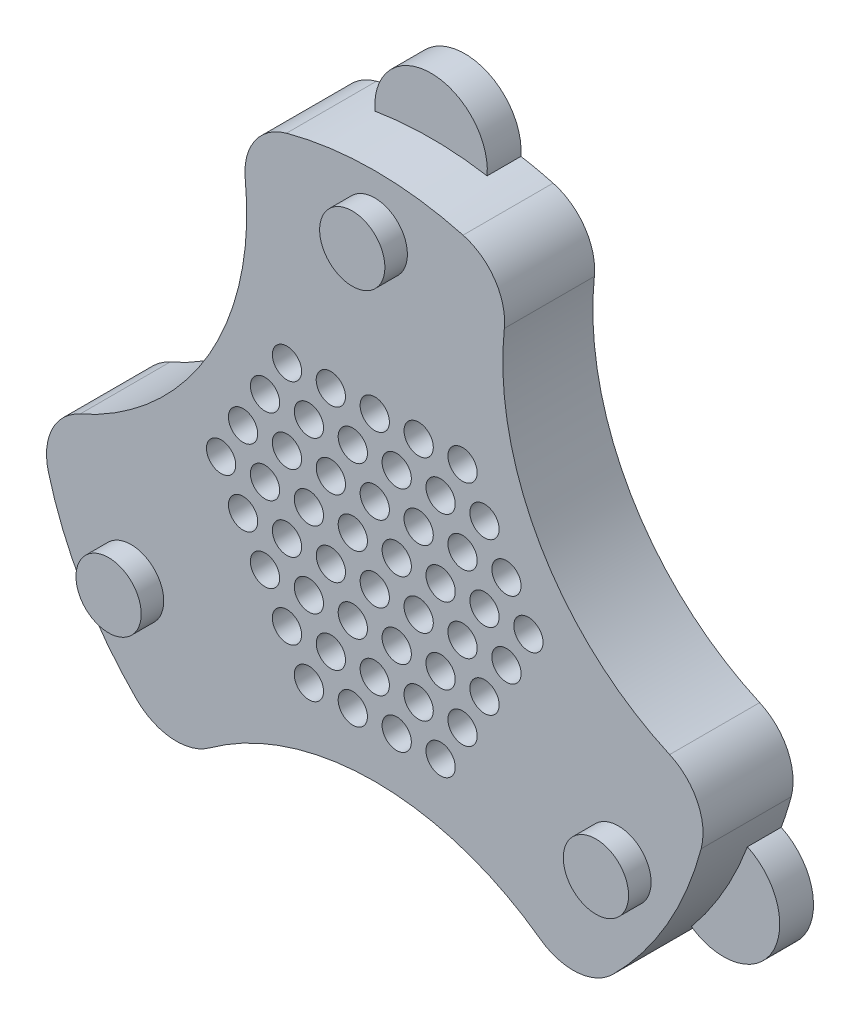
from build123d import *

# Parameters (mm, degrees)
SKETCH2_R           = 19
SKETCH2_R_2         = 1.3
BOSS_EXTRUDE1_DEPTH = 8
SKETCH3_R           = 30
SKETCH3_R_2         = 17.487995661
BOSS_EXTRUDE2_DEPTH = 8
SKETCH4_R           = 2.9
BOSS_EXTRUDE3_DEPTH = 2
SKETCH6_R           = 5
BOSS_EXTRUDE4_DEPTH = 3
SKETCH5_R           = 3
CUT_EXTRUDE1_DEPTH  = 3
SKETCH7_R           = 25
CUT_EXTRUDE2_DEPTH  = 8
FILLET2_R           = 5


with BuildPart() as part:
    # Sketch2 → Boss-Extrude1 (new body)
    with BuildSketch(Plane.XY.offset(10)):
        Circle(SKETCH2_R)
        with Locations((0, -2.215732779)):
            Circle(SKETCH2_R_2, mode=Mode.SUBTRACT)
        with Locations((3.9, -2.215732779)):
            Circle(SKETCH2_R_2, mode=Mode.SUBTRACT)
        with Locations((7.8, -2.215732779)):
            Circle(SKETCH2_R_2, mode=Mode.SUBTRACT)
        with Locations((11.7, -2.215732779)):
            Circle(SKETCH2_R_2, mode=Mode.SUBTRACT)
        with Locations((1.95, -5.593231854)):
            Circle(SKETCH2_R_2, mode=Mode.SUBTRACT)
        with Locations((3.9, -8.970730929)):
            Circle(SKETCH2_R_2, mode=Mode.SUBTRACT)
        with Locations((5.850000003, -12.348230002)):
            Circle(SKETCH2_R_2, mode=Mode.SUBTRACT)
        with Locations((-1.95, -5.593231854)):
            Circle(SKETCH2_R_2, mode=Mode.SUBTRACT)
        with Locations((-3.9, -8.970730929)):
            Circle(SKETCH2_R_2, mode=Mode.SUBTRACT)
        with Locations((-5.85, -12.348230004)):
            Circle(SKETCH2_R_2, mode=Mode.SUBTRACT)
        with Locations((-3.9, -2.215732779)):
            Circle(SKETCH2_R_2, mode=Mode.SUBTRACT)
        with Locations((-7.8, -2.215732779)):
            Circle(SKETCH2_R_2, mode=Mode.SUBTRACT)
        with Locations((-11.7, -2.215732779)):
            Circle(SKETCH2_R_2, mode=Mode.SUBTRACT)
        with Locations((-1.950000001, 1.161766295)):
            Circle(SKETCH2_R_2, mode=Mode.SUBTRACT)
        with Locations((-3.9, 4.53926537)):
            Circle(SKETCH2_R_2, mode=Mode.SUBTRACT)
        with Locations((-5.85, 7.916764445)):
            Circle(SKETCH2_R_2, mode=Mode.SUBTRACT)
        with Locations((-7.8, 11.29426352)):
            Circle(SKETCH2_R_2, mode=Mode.SUBTRACT)
        with Locations((1.95, 1.161766295)):
            Circle(SKETCH2_R_2, mode=Mode.SUBTRACT)
        with Locations((3.9, 4.53926537)):
            Circle(SKETCH2_R_2, mode=Mode.SUBTRACT)
        with Locations((5.85, 7.916764445)):
            Circle(SKETCH2_R_2, mode=Mode.SUBTRACT)
        with Locations((7.8, 11.29426352)):
            Circle(SKETCH2_R_2, mode=Mode.SUBTRACT)
        with Locations((5.85, 1.161766295)):
            Circle(SKETCH2_R_2, mode=Mode.SUBTRACT)
        with Locations((7.8, 4.53926537)):
            Circle(SKETCH2_R_2, mode=Mode.SUBTRACT)
        with Locations((9.75, 1.161766295)):
            Circle(SKETCH2_R_2, mode=Mode.SUBTRACT)
        with Locations((11.7, 4.53926537)):
            Circle(SKETCH2_R_2, mode=Mode.SUBTRACT)
        with Locations((9.749099848, 7.918323553)):
            Circle(SKETCH2_R_2, mode=Mode.SUBTRACT)
        with Locations((13.650900152, 1.160207187)):
            Circle(SKETCH2_R_2, mode=Mode.SUBTRACT)
        with Locations((5.850000208, -5.594790783)):
            Circle(SKETCH2_R_2, mode=Mode.SUBTRACT)
        with Locations((9.750000208, -5.594790782)):
            Circle(SKETCH2_R_2, mode=Mode.SUBTRACT)
        with Locations((7.800000209, -8.972289857)):
            Circle(SKETCH2_R_2, mode=Mode.SUBTRACT)
        with Locations((-0.00134976, -8.973069502)):
            Circle(SKETCH2_R_2, mode=Mode.SUBTRACT)
        with Locations((1.94865024, -12.350568576)):
            Circle(SKETCH2_R_2, mode=Mode.SUBTRACT)
        with Locations((-1.95134976, -12.350568576)):
            Circle(SKETCH2_R_2, mode=Mode.SUBTRACT)
        with Locations((-5.852699936, -5.594791143)):
            Circle(SKETCH2_R_2, mode=Mode.SUBTRACT)
        with Locations((-7.802699936, -8.972290217)):
            Circle(SKETCH2_R_2, mode=Mode.SUBTRACT)
        with Locations((-9.752699936, -5.594791143)):
            Circle(SKETCH2_R_2, mode=Mode.SUBTRACT)
        with Locations((-5.852700144, 1.161765936)):
            Circle(SKETCH2_R_2, mode=Mode.SUBTRACT)
        with Locations((-9.752700144, 1.161765936)):
            Circle(SKETCH2_R_2, mode=Mode.SUBTRACT)
        with Locations((-7.802700144, 4.53926501)):
            Circle(SKETCH2_R_2, mode=Mode.SUBTRACT)
        with Locations((-11.702700144, 4.53926501)):
            Circle(SKETCH2_R_2, mode=Mode.SUBTRACT)
        with Locations((-9.751799992, 7.918323194)):
            Circle(SKETCH2_R_2, mode=Mode.SUBTRACT)
        with Locations((-13.653600295, 1.160206827)):
            Circle(SKETCH2_R_2, mode=Mode.SUBTRACT)
        with Locations((-0.001350176, 4.540044654)):
            Circle(SKETCH2_R_2, mode=Mode.SUBTRACT)
        with Locations((-1.951350176, 7.917543729)):
            Circle(SKETCH2_R_2, mode=Mode.SUBTRACT)
        with Locations((1.948649824, 7.917543729)):
            Circle(SKETCH2_R_2, mode=Mode.SUBTRACT)
        with Locations((-0.001350176, 11.295042804)):
            Circle(SKETCH2_R_2, mode=Mode.SUBTRACT)
        with Locations((3.900450128, 11.295042804)):
            Circle(SKETCH2_R_2, mode=Mode.SUBTRACT)
        with Locations((-3.903150479, 11.295042804)):
            Circle(SKETCH2_R_2, mode=Mode.SUBTRACT)
    extrude(amount=BOSS_EXTRUDE1_DEPTH)

    # Sketch3 → Boss-Extrude2 (add)
    with BuildSketch(Plane.XY.offset(18)):
        Circle(SKETCH3_R)
        Circle(SKETCH3_R_2, mode=Mode.SUBTRACT)
    extrude(amount=-BOSS_EXTRUDE2_DEPTH)

    # Sketch4 → Boss-Extrude3 (add)
    with BuildSketch(Plane.XY.offset(18)):
        with Locations((0, 25)):
            Circle(SKETCH4_R)
        with Locations((21.650635095, -12.5)):
            Circle(SKETCH4_R)
        with Locations((-21.650635095, -12.5)):
            Circle(SKETCH4_R)
    extrude(amount=BOSS_EXTRUDE3_DEPTH)

    # Sketch6 → Boss-Extrude4 (add)
    with BuildSketch(Plane(origin=(0, 0, 10), x_dir=(-1, 0, 0), z_dir=(0, 0, -1))):
        with Locations((0, 30)):
            Circle(SKETCH6_R)
        with Locations((25.980762114, -15)):
            Circle(SKETCH6_R)
        with Locations((-25.980762114, -15)):
            Circle(SKETCH6_R)
    extrude(amount=-BOSS_EXTRUDE4_DEPTH)

    # Sketch5 → Cut-Extrude1 (cut)
    with BuildSketch(Plane(origin=(0, 0, 10), x_dir=(-1, 0, 0), z_dir=(0, 0, -1))):
        with Locations((0, 25)):
            Circle(SKETCH5_R)
        with Locations((21.650635095, -12.5)):
            Circle(SKETCH5_R)
        with Locations((-21.650635095, -12.5)):
            Circle(SKETCH5_R)
    extrude(amount=-CUT_EXTRUDE1_DEPTH, mode=Mode.SUBTRACT)

    # Sketch7 → Cut-Extrude2 (cut)
    with BuildSketch(Plane(origin=(0, 0, 10), x_dir=(-1, 0, 0), z_dir=(0, 0, -1))):
        with Locations((36.373066959, 21)):
            Circle(SKETCH7_R)
        with Locations((0, -42)):
            Circle(SKETCH7_R)
        with Locations((-36.373066959, 21)):
            Circle(SKETCH7_R)
    extrude(amount=-CUT_EXTRUDE2_DEPTH, mode=Mode.SUBTRACT)

    # Fillet2
    fillet2_edges = [part.edges().sort_by_distance(p)[0] for p in [
        (29.836243213, -3.130270104, 14),
        (12.207228175, 27.404079628, 14),
        (-12.207228175, 27.404079628, 14),
        (-29.836243213, -3.130270104, 14),
        (-17.629015038, -24.273809524, 14),
        (17.629015038, -24.273809524, 14),
    ]]
    fillet(fillet2_edges, radius=FILLET2_R)


solid = part.part
